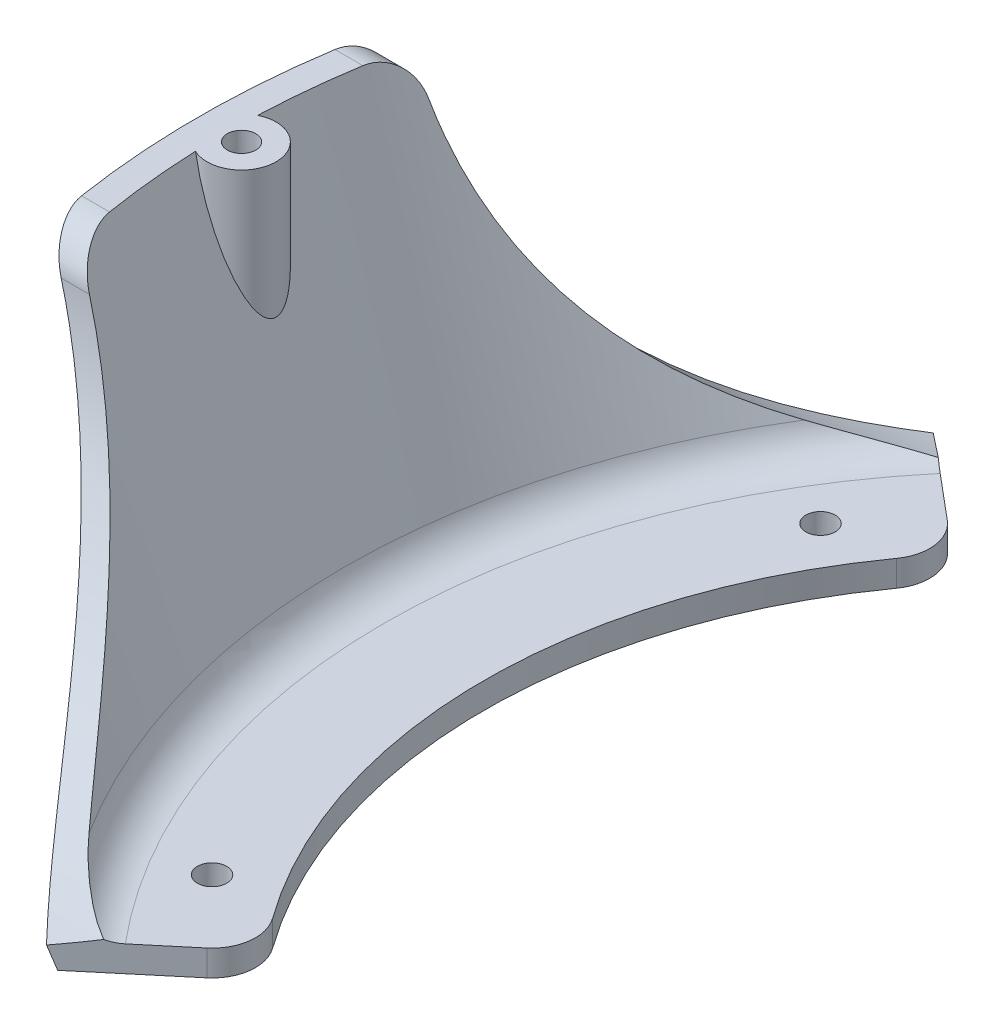
from build123d import *

# Parameters (mm, degrees)
R_VOLUTION1_ANGLE                         = 80
BOSS_EXTRU_1_REACH                        = 122.843
ESQUISSE3_R                               = 4
TROU_POUR_TARAUDAGE_POUR_TROU_TARAUD_M4_D = 3.3
D_GAGEMENT_M31_D                          = 3.4
ESQUISSE8_R                               = 41.654908191
ENL_V_MAT_EXTRU_1_DEPTH                   = 121.842511717
CONG_1_R                                  = 5


with BuildPart() as part:
    # Esquisse1 → Révolution1 (revolve, symmetric)
    with BuildSketch(Plane.XY) as r_volution1_sk:
        Polygon((-61.915329373, 0), (-79, 0), (-95, 43), (-91.799050303, 43), (-76.915329373, 3), (-61.915329373, 3), align=None)
    revolve(axis=Axis((0, 0, 0), (0, 1, 0)), revolution_arc=R_VOLUTION1_ANGLE / 2)
    revolve(r_volution1_sk.sketch, axis=Axis((0, 0, 0), (0, -1, 0)), revolution_arc=R_VOLUTION1_ANGLE / 2)

    # Esquisse3 → Boss.-Extru.1 (add, up to next)
    with BuildSketch(Plane(origin=(0, 43, 0), x_dir=(1, 0, 0), z_dir=(0, 1, 0)), mode=Mode.PRIVATE) as boss_extru_1_sk1:
        with Locations((-90, 0)):
            Circle(ESQUISSE3_R)
    boss_extru_1_tool1 = extrude(boss_extru_1_sk1.sketch, amount=-BOSS_EXTRU_1_REACH, mode=Mode.PRIVATE) - part.part
    add(boss_extru_1_tool1.solids().sort_by_distance((-90, 43, 0))[0])

    # Trou pour taraudage pour trou taraudé M41 (through all)
    with Locations(Plane(origin=(0, 43, 0), x_dir=(1, 0, 0), z_dir=(0, 1, 0))):
        with Locations((-90, 0)):
            Hole(TROU_POUR_TARAUDAGE_POUR_TROU_TARAUD_M4_D / 2)

    # Dégagement M31 (through all)
    with Locations(Plane(origin=(0, 3, 0), x_dir=(1, 0, 0), z_dir=(0, 1, 0))):
        with Locations((-58.168039621, 35.25), (-58.168039621, -35.25)):
            Hole(D_GAGEMENT_M31_D / 2)

    # Esquisse8 → Enlèv. mat.-Extru.1 (cut, through all)
    with BuildSketch(Plane(origin=(0, 0, 0), x_dir=(0, 0, -1), z_dir=(1, 0, 0))):
        with Locations((-61.06482292, 43)):
            Circle(ESQUISSE8_R)
        with Locations((61.06482292, 43)):
            Circle(ESQUISSE8_R)
    extrude(amount=-ENL_V_MAT_EXTRU_1_DEPTH, mode=Mode.SUBTRACT)

    # Congé1
    cong_1_edges = [part.edges().sort_by_distance(p)[0] for p in [
        (-76.915329373, 3, 0),
        (-91.359787942, 43, -19.409914729),
        (-91.359787942, 43, 19.409914729),
        (-47.42989401, 1.5, -39.798406571),
        (-47.42989401, 1.5, 39.798406571),
    ]]
    fillet(cong_1_edges, radius=CONG_1_R)


solid = part.part
